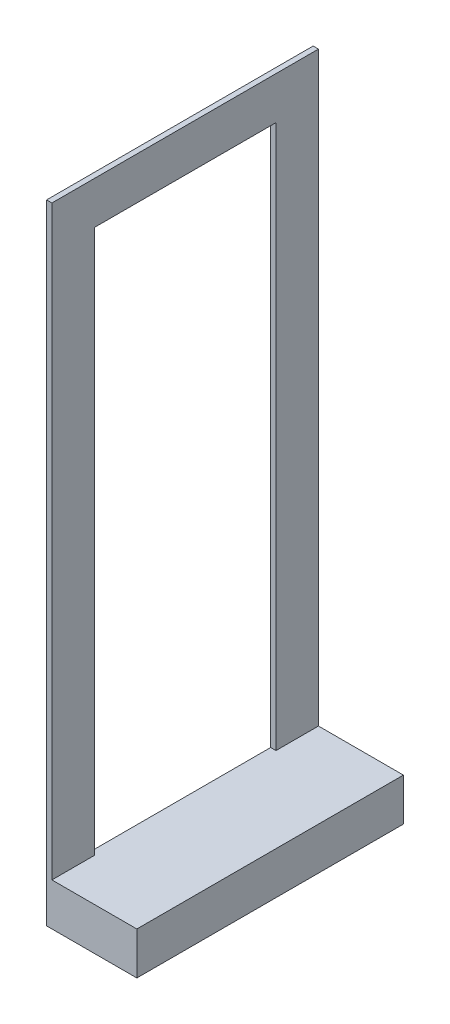
from build123d import *

# Parameters (mm, degrees)
SKETCH1_W           = 79.713100929
SKETCH1_H           = 188.030607332
SKETCH1_W_2         = 54.313100929
SKETCH1_H_2         = 162.630607332
EXTRUDE_THIN1_DEPTH = 1.5875
EXTRUDE_THIN2_START = -179.324
SKETCH1_3_W         = 79.713100929
SKETCH1_3_H         = 188.030607332
SKETCH1_3_W_2       = 54.313100929
SKETCH1_3_H_2       = 162.630607332
EXTRUDE_THIN2_DEPTH = 1.5875
SKETCH2_W           = 79.713100929
SKETCH2_H           = 12.7
BOSS_EXTRUDE3_DEPTH = 25.4
BOSS_EXTRUDE4_START = -182.499
SKETCH2_2_W         = 79.713100929
SKETCH2_2_H         = 12.7
BOSS_EXTRUDE4_DEPTH = 25.4
SKETCH3_W           = 117.076053855
SKETCH3_H           = 196.691722882
CUT_EXTRUDE1_DEPTH  = 291.300056469


with BuildPart() as part:
    # Sketch1 → Extrude-Thin1 (new body)
    with BuildSketch(Plane(origin=(179.324, 0, 0), x_dir=(0, 0, -1), z_dir=(1, 0, 0))):
        with Locations((39.856550465, 94.015303666)):
            Rectangle(SKETCH1_W, SKETCH1_H)
        with Locations((39.856550465, 94.015303666)):
            Rectangle(SKETCH1_W_2, SKETCH1_H_2, mode=Mode.SUBTRACT)
    extrude(amount=EXTRUDE_THIN1_DEPTH)

    # Sketch2 → Boss-Extrude3 (add)
    with BuildSketch(Plane(origin=(180.9115, 0, 0), x_dir=(0, 0, -1), z_dir=(1, 0, 0))):
        with Locations((39.856550465, 6.35)):
            Rectangle(SKETCH2_W, SKETCH2_H)
    extrude(amount=BOSS_EXTRUDE3_DEPTH)


with BuildPart() as body_2:
    # Sketch1<3> → Extrude-Thin2 (new body)
    with BuildSketch(Plane(origin=(179.324, 0, 0), x_dir=(0, 0, -1), z_dir=(1, 0, 0)).offset(EXTRUDE_THIN2_START)):
        with Locations((39.856550465, 94.015303666)):
            Rectangle(SKETCH1_3_W, SKETCH1_3_H)
        with Locations((39.856550465, 94.015303666)):
            Rectangle(SKETCH1_3_W_2, SKETCH1_3_H_2, mode=Mode.SUBTRACT)
    extrude(amount=-EXTRUDE_THIN2_DEPTH)

    # Sketch2<2> → Boss-Extrude4 (add)
    with BuildSketch(Plane(origin=(180.9115, 0, 0), x_dir=(0, 0, -1), z_dir=(1, 0, 0)).offset(BOSS_EXTRUDE4_START)):
        with Locations((39.856550465, 6.35)):
            Rectangle(SKETCH2_2_W, SKETCH2_2_H)
    extrude(amount=-BOSS_EXTRUDE4_DEPTH)

    # Sketch3 → Cut-Extrude1 (cut, through all)
    with BuildSketch(Plane(origin=(0, 0, 0), x_dir=(0, 0, -1), z_dir=(1, 0, 0))):
        with Locations((58.538026928, 98.345861441)):
            Rectangle(SKETCH3_W, SKETCH3_H)
    extrude(amount=-CUT_EXTRUDE1_DEPTH, mode=Mode.SUBTRACT)


solid = part.part
